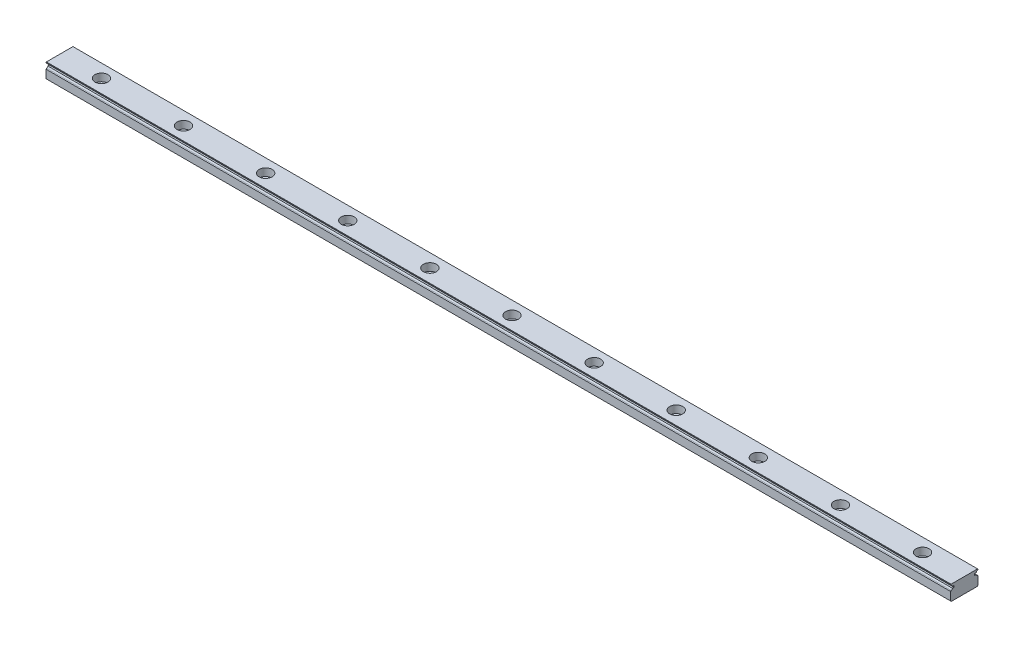
from build123d import *

# Parameters (mm, degrees)
SKETCH1_W                                    = 20
SKETCH1_H                                    = 11
BOSS_EXTRUDE1_DEPTH                          = 661
CUT_EXTRUDE2_DEPTH                           = 662.167149819
CBORE_FOR_SOCKET_HEAD_CAP_SCREW1_D           = 6
CBORE_FOR_SOCKET_HEAD_CAP_SCREW1_CBORE_D     = 9.5
CBORE_FOR_SOCKET_HEAD_CAP_SCREW1_CBORE_DEPTH = 5.5
LPATTERN1_COUNT                              = 11
LPATTERN1_PITCH                              = 60
CHAMFER1_SIZE                                = 0.3
CHAMFER2_SIZE                                = 0.5


with BuildPart() as part:
    # Sketch1 → Boss-Extrude1 (new body)
    with BuildSketch(Plane(origin=(-30.5, 0, 0), x_dir=(0, 0, -1), z_dir=(1, 0, 0))):
        with Locations((0, 5.5)):
            Rectangle(SKETCH1_W, SKETCH1_H)
    extrude(amount=BOSS_EXTRUDE1_DEPTH)

    # Sketch3 → Cut-Extrude2 (cut, through all)
    with BuildSketch(Plane(origin=(-30.5, 0, 0), x_dir=(0, 0, -1), z_dir=(1, 0, 0))):
        with BuildLine():
            Line((10, 10.451039482), (9.455259378, 10.141421591))
            ThreePointArc((9.455259378, 10.141421591), (8.943868436, 9.701092928), (8.637115571, 9.1))
            Line((8.637115571, 9.1), (7.5, 9.1))
            Line((7.5, 9.1), (7.5, 7.9))
            Line((7.5, 7.9), (8.64, 7.9))
            ThreePointArc((8.64, 7.9), (8.939788863, 7.314120259), (9.434780564, 6.880401858))
            Line((9.434780564, 6.880401858), (10, 6.548960518))
            Line((10, 6.548960518), (10, 10.451039482))
        make_face()
        with BuildLine():
            Line((-10, 10.451039482), (-10, 6.548960518))
            Line((-10, 6.548960518), (-9.434780564, 6.880401858))
            ThreePointArc((-9.434780564, 6.880401858), (-8.939788863, 7.314120259), (-8.64, 7.9))
            Line((-8.64, 7.9), (-7.5, 7.9))
            Line((-7.5, 7.9), (-7.5, 9.1))
            Line((-7.5, 9.1), (-8.637115571, 9.1))
            ThreePointArc((-8.637115571, 9.1), (-8.943868436, 9.701092928), (-9.455259378, 10.141421591))
            Line((-9.455259378, 10.141421591), (-10, 10.451039482))
        make_face()
    extrude(amount=CUT_EXTRUDE2_DEPTH, mode=Mode.SUBTRACT)

    # CBORE for Socket Head Cap Screw1 (through all)
    with Locations(Plane(origin=(0, 11, 0), x_dir=(1, 0, 0), z_dir=(0, 1, 0))):
        with Locations((0, 0)):
            cbore_for_socket_head_cap_screw1 = CounterBoreHole(CBORE_FOR_SOCKET_HEAD_CAP_SCREW1_D / 2, CBORE_FOR_SOCKET_HEAD_CAP_SCREW1_CBORE_D / 2, CBORE_FOR_SOCKET_HEAD_CAP_SCREW1_CBORE_DEPTH)

    # LPattern1: CBORE for Socket Head Cap Screw1 ×11
    with Locations(*[(i * LPATTERN1_PITCH, 0, 0) for i in range(1, LPATTERN1_COUNT)]):
        add(cbore_for_socket_head_cap_screw1, mode=Mode.SUBTRACT)

    # Chamfer1
    chamfer1_edges = [part.edges().sort_by_distance(p)[0] for p in [
        (300, 11, -10),
        (300, 11, 10),
    ]]
    chamfer(chamfer1_edges, length=CHAMFER1_SIZE)

    # Chamfer2
    chamfer2_edges = [part.edges().sort_by_distance(p)[0] for p in [
        (300, 0, -10),
        (300, 0, 10),
    ]]
    chamfer(chamfer2_edges, length=CHAMFER2_SIZE)


solid = part.part
